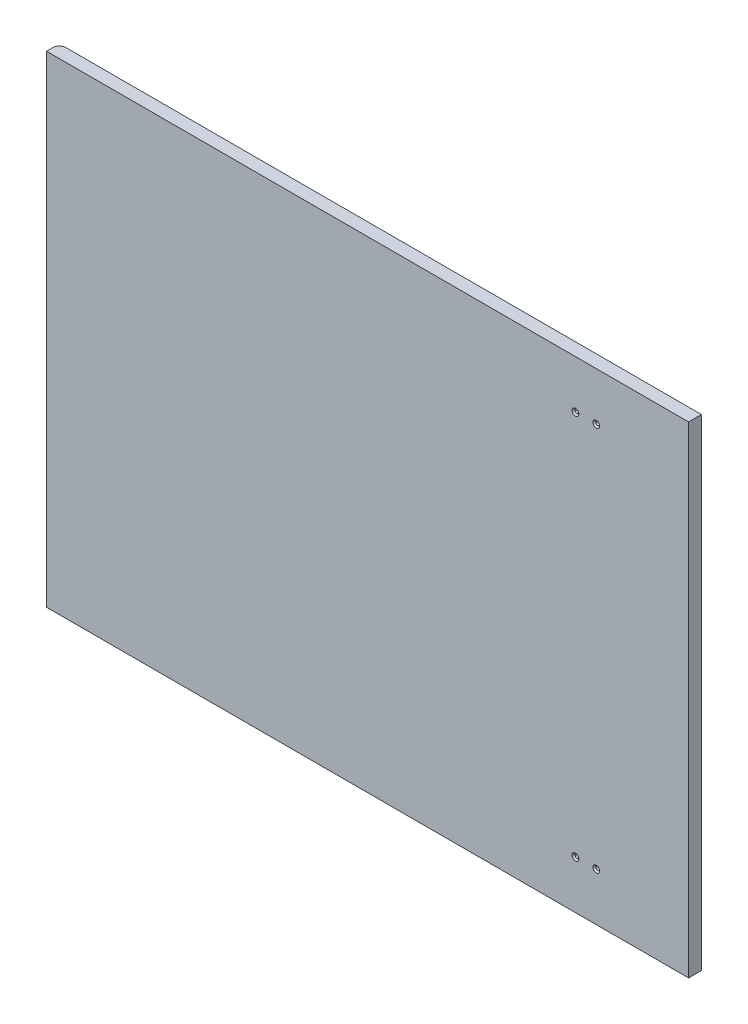
from build123d import *

# Parameters (mm, degrees)
SKETCH1_W                                 = 800
SKETCH1_H                                 = 600
BOSS_EXTRUDE1_DEPTH                       = 16
CSK_FOR_8_FLAT_HEAD_MACHINE_SCREW_2_COUNT = 2
CSK_FOR_8_FLAT_HEAD_MACHINE_SCREW_2_PITCH = 26
FILLET1_R                                 = 8


with BuildPart() as part:
    # Sketch1 → Boss-Extrude1 (new body)
    with BuildSketch(Plane.XY):
        Rectangle(SKETCH1_W, SKETCH1_H)
    extrude(amount=BOSS_EXTRUDE1_DEPTH)

    # Sketch3 → CSK for #8 Flat Head Machine Screw (100)1 (revolve, cut)
    with BuildSketch(Plane(origin=(285, -240, 16), x_dir=(0, -1, 0), z_dir=(1, 0, 0))):
        Polygon((0, 0), (0, 26.350674586), (2.2479, 25), (2.2479, 1.651767624), (4.2164, 0), align=None)
    csk_for_8_flat_head_machine_screw_100 = revolve(axis=Axis((285, -240, 22.35), (0, 0, -1)), mode=Mode.SUBTRACT)

    # CSK for _8 Flat Head Machine Screw _ 2: CSK for #8 Flat Head Machine Screw (100)1 ×2
    with Locations(*[(-i * CSK_FOR_8_FLAT_HEAD_MACHINE_SCREW_2_PITCH, 0, 0) for i in range(1, CSK_FOR_8_FLAT_HEAD_MACHINE_SCREW_2_COUNT)]):
        add(csk_for_8_flat_head_machine_screw_100, mode=Mode.SUBTRACT)

    # Mirror1: CSK for #8 Flat Head Machine Screw (100)1 across plane
    add(csk_for_8_flat_head_machine_screw_100.mirror(Plane.ZX), mode=Mode.SUBTRACT)

    # Mirror1 copy 1 sketch → Mirror1 copy 1 (revolve, cut)
    with BuildSketch(Plane(origin=(259, 240, 16), x_dir=(0, 1, 0), z_dir=(1, 0, 0))):
        Polygon((0, 0), (0, -26.350674586), (2.2479, -25), (2.2479, -1.651767624), (4.2164, 0), align=None)
    revolve(axis=Axis((259, 240, 22.35), (0, 0, 1)), mode=Mode.SUBTRACT)

    # Fillet1
    fillet1_edges = [part.edges().sort_by_distance(p)[0] for p in [
        (-400, 0, 0),
    ]]
    fillet(fillet1_edges, radius=FILLET1_R)


solid = part.part
